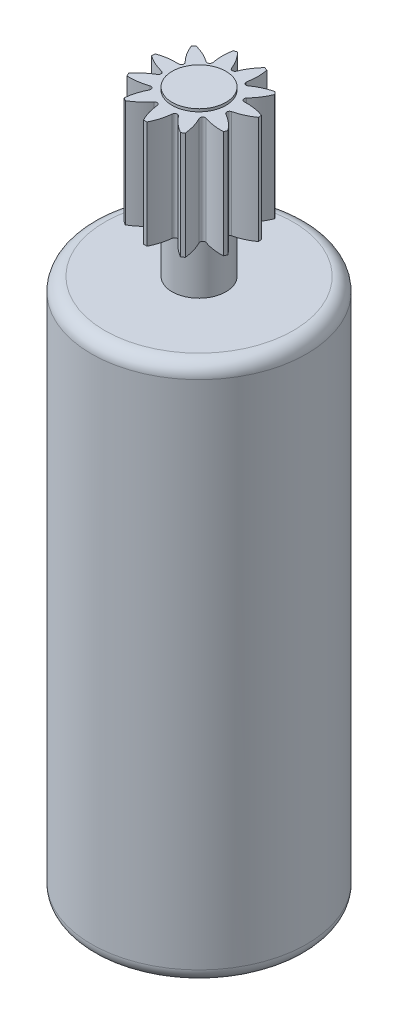
from build123d import *

# Parameters (mm, degrees)
FILLET1_R          = 0.5
CUT_EXTRUDE1_START = -4
CUT_EXTRUDE1_DEPTH = 31.608269391
CIRPATTERN1_COUNT  = 11


with BuildPart() as part:
    # Sketch2 → Revolve1 (revolve)
    with BuildSketch(Plane.XY, mode=Mode.PRIVATE) as revolve1_sk:
        Polygon((0, 0), (0, 26.1), (1, 26.1), (1, 26), (2, 26), (2, 22), (1, 22), (1, 20), (4, 20), (4, 0), align=None)
    revolve(revolve1_sk.sketch.rotate(Axis((0, 0, 0), (0, 1, 0)), 90), axis=Axis((0, 0, 0), (0, 1, 0)))

    # Fillet1
    fillet1_edges = [part.edges().sort_by_distance(p)[0] for p in [
        (0, 20, 4),
        (0, 0, 4),
    ]]
    fillet(fillet1_edges, radius=FILLET1_R)

    # Sketch5 → Cut-Extrude1 (cut)
    with BuildSketch(Plane(origin=(0, 26, 0), x_dir=(1, 0, 0), z_dir=(0, 1, 0)).offset(CUT_EXTRUDE1_START)):
        with BuildLine():
            ThreePointArc((-0.5, 1.936491673), (-0.266119458, 1.637619869), (-0.092905413, 1.299949383))
            ThreePointArc((-0.092905413, 1.299949383), (0, 1.236943764), (0.092905413, 1.299949383))
            ThreePointArc((0.092905413, 1.299949383), (0.266119458, 1.637619869), (0.5, 1.936491673))
            ThreePointArc((0.5, 1.936491673), (0, 2), (-0.5, 1.936491673))
        make_face()
    cut_extrude1 = extrude(amount=CUT_EXTRUDE1_DEPTH, mode=Mode.SUBTRACT)

    # CirPattern1: Cut-Extrude1 ×11 about axis
    cirpattern1_axis = Axis((0, 26, 0), (0, -1, 0))
    for i in range(1, CIRPATTERN1_COUNT):
        add(cut_extrude1.rotate(cirpattern1_axis, i * 360 / CIRPATTERN1_COUNT), mode=Mode.SUBTRACT)


solid = part.part
